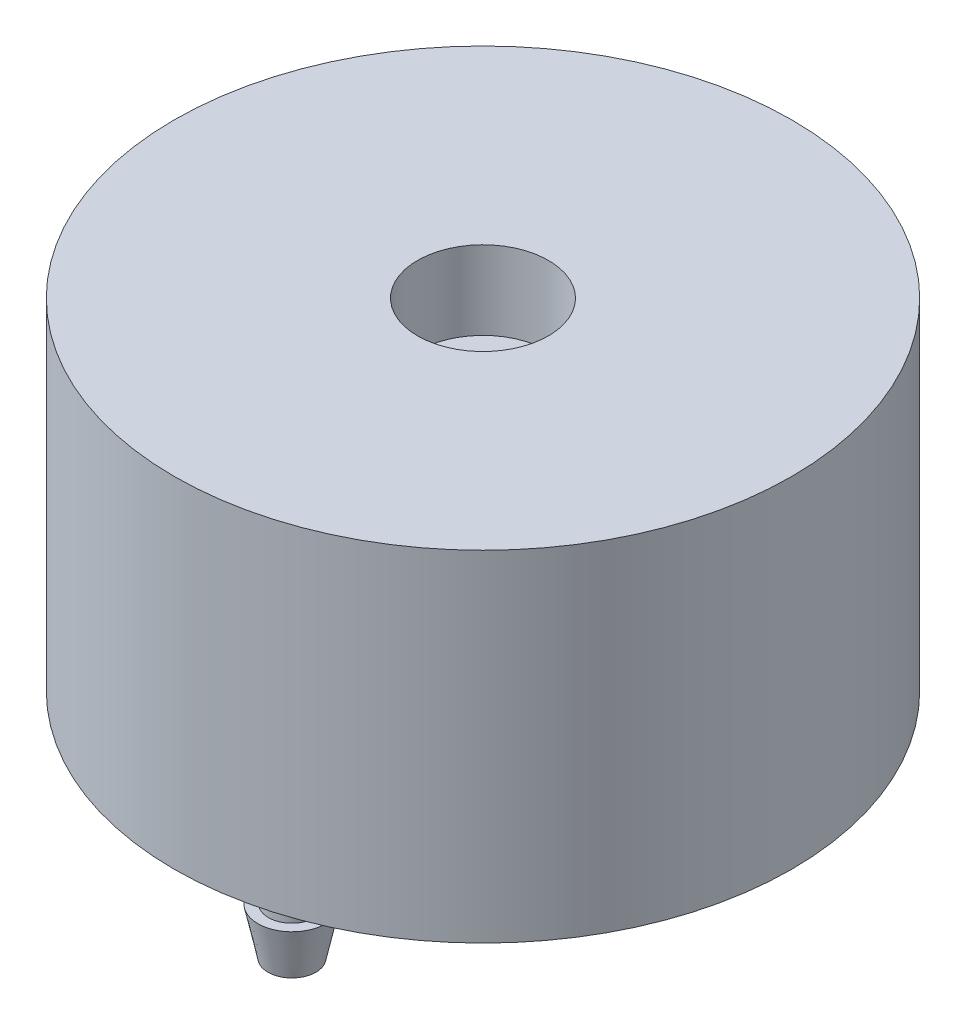
from build123d import *

# Parameters (mm, degrees)
ESQUISSE1_R                  = 5.9
BOSS_EXTRU_1_DEPTH           = 5
COQUE1_T                     = -0.5
ESQUISSE2_R                  = 5.9
ESQUISSE2_R_2                = 1.25
BOSS_EXTRU_2_DEPTH           = 1.5
ESQUISSE3_R                  = 4.5
BOSS_EXTRU_3_DEPTH           = 4
ESQUISSE4_R                  = 0.45
BOSS_EXTRU_4_DEPTH           = 2.6
ESQUISSE5_R                  = 0.65
BOSS_EXTRU_5_DEPTH           = 0.9
BOSS_EXTRU_5_DRAFT           = -12
BOSS_EXTRU_5_PROFILE_2_DEPTH = 0.9
BOSS_EXTRU_5_PROFILE_2_DRAFT = -12


with BuildPart() as part:
    # Esquisse1 → Boss.-Extru.1 (new body)
    with BuildSketch(Plane(origin=(0, 0, 0), x_dir=(1, 0, 0), z_dir=(0, 1, 0))):
        with Locations(Location((0, 0, 0), (0, 0, 270))):
            Circle(ESQUISSE1_R)
    extrude(amount=BOSS_EXTRU_1_DEPTH)

    # Coque1
    coque1_openings = [part.faces().sort_by_distance(p)[0] for p in [
        (0, 5, 0),
    ]]
    offset(amount=COQUE1_T, openings=coque1_openings, kind=Kind.INTERSECTION)

    # Esquisse2 → Boss.-Extru.2 (add)
    with BuildSketch(Plane(origin=(0, 5, 0), x_dir=(1, 0, 0), z_dir=(0, 1, 0))):
        with Locations(Location((0, 0, 0), (0, 0, 270))):
            Circle(ESQUISSE2_R)
        with Locations(Location((0, 0, 0), (0, 0, 270))):
            Circle(ESQUISSE2_R_2, mode=Mode.SUBTRACT)
    extrude(amount=BOSS_EXTRU_2_DEPTH)

    # Esquisse3 → Boss.-Extru.3 (add)
    with BuildSketch(Plane(origin=(0, 0.5, 0), x_dir=(1, 0, 0), z_dir=(0, 1, 0))):
        with Locations(Location((0, 0, 0), (0, 0, 270))):
            Circle(ESQUISSE3_R)
    extrude(amount=BOSS_EXTRU_3_DEPTH)

    # Esquisse4 → Boss.-Extru.4 (add)
    with BuildSketch(Plane.XZ):
        with Locations(Location((0, 3.65, 0), (0, 0, 90))):
            Circle(ESQUISSE4_R)
        with Locations(Location((0, -3.647, 0), (0, 0, 90))):
            Circle(ESQUISSE4_R)
    extrude(amount=BOSS_EXTRU_4_DEPTH)


with BuildPart() as boss_extru_5_tool:
    # Esquisse5 → Boss.-Extru.5 (with draft: the straight prism first)
    with BuildSketch(Plane(origin=(0, -1.7, 0), x_dir=(1, 0, 0), z_dir=(0, 1, 0))):
        with Locations((0, -3.65)):
            Circle(ESQUISSE5_R)
    extrude(amount=-BOSS_EXTRU_5_DEPTH)
    # Boss.-Extru.5: the draft: its side faces are tilted about the plane it starts from
    boss_extru_5_sides = [boss_extru_5_tool.faces().sort_by_distance(p)[0] for p in [
        (-0.65, -2.15, 3.65),
    ]]
    draft(boss_extru_5_sides, Plane(origin=(0, -1.7, 0), x_dir=(1, 0, 0), z_dir=(0, 1, 0)), BOSS_EXTRU_5_DRAFT)


with BuildPart() as part_1:
    add(part.part)

    # Boss.-Extru.5: add boss_extru_5_tool
    add(boss_extru_5_tool.part)


with BuildPart() as boss_extru_5_profile_2_tool:
    # Esquisse5 → Boss.-Extru.5 profile 2 (with draft: the straight prism first)
    with BuildSketch(Plane(origin=(0, -1.7, 0), x_dir=(1, 0, 0), z_dir=(0, 1, 0))):
        with Locations((0, 3.647)):
            Circle(ESQUISSE5_R)
    extrude(amount=-BOSS_EXTRU_5_PROFILE_2_DEPTH)
    # Boss.-Extru.5 profile 2: the draft: its side faces are tilted about the plane it starts from
    boss_extru_5_profile_2_sides = [boss_extru_5_profile_2_tool.faces().sort_by_distance(p)[0] for p in [
        (-0.65, -2.15, -3.647),
    ]]
    draft(boss_extru_5_profile_2_sides, Plane(origin=(0, -1.7, 0), x_dir=(1, 0, 0), z_dir=(0, 1, 0)), BOSS_EXTRU_5_PROFILE_2_DRAFT)


with BuildPart() as part_2:
    add(part_1.part)

    # Boss.-Extru.5 profile 2: add boss_extru_5_profile_2_tool
    add(boss_extru_5_profile_2_tool.part)


solid = part_2.part
